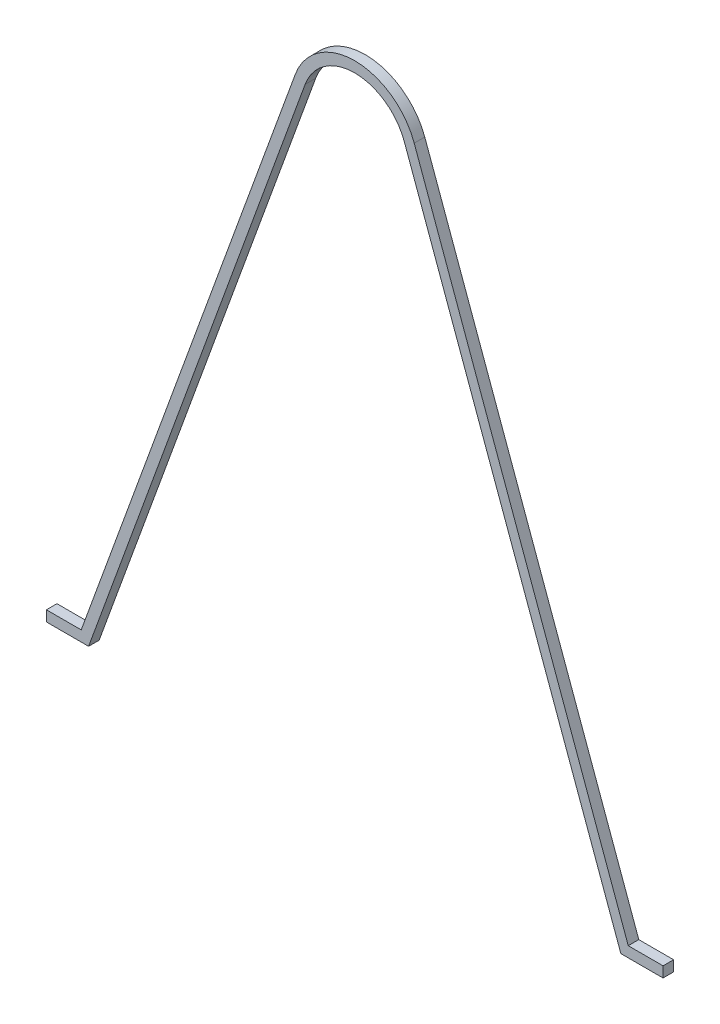
from build123d import *

# Parameters (mm, degrees)
EXTRUDE_1_DEPTH = 10


with BuildPart() as part:
    # Эскиз1 → Бобышка-Вытянуть1 (new body)
    with BuildSketch(Plane.XY):
        with BuildLine():
            Line((-292.196717035, -546.714565305), (-252.196717035, -546.714565305))
            Line((-252.196717035, -546.714565305), (-46.984631039, 17.101007166))
            ThreePointArc((-46.984631039, 17.101007166), (0, 50), (46.984631039, 17.101007166))
            Line((46.984631039, 17.101007166), (252.196717035, -546.714565305))
            Line((252.196717035, -546.714565305), (292.196717035, -546.714565305))
            Line((292.196717035, -546.714565305), (292.196717035, -536.714565305))
            Line((292.196717035, -536.714565305), (259.198792417, -536.714565305))
            Line((259.198792417, -536.714565305), (56.381557247, 20.5212086))
            ThreePointArc((56.381557247, 20.5212086), (0, 60), (-56.381557247, 20.5212086))
            Line((-56.381557247, 20.5212086), (-259.198792417, -536.714565305))
            Line((-259.198792417, -536.714565305), (-292.196717035, -536.714565305))
            Line((-292.196717035, -536.714565305), (-292.196717035, -546.714565305))
        make_face()
    extrude(amount=EXTRUDE_1_DEPTH)


solid = part.part
